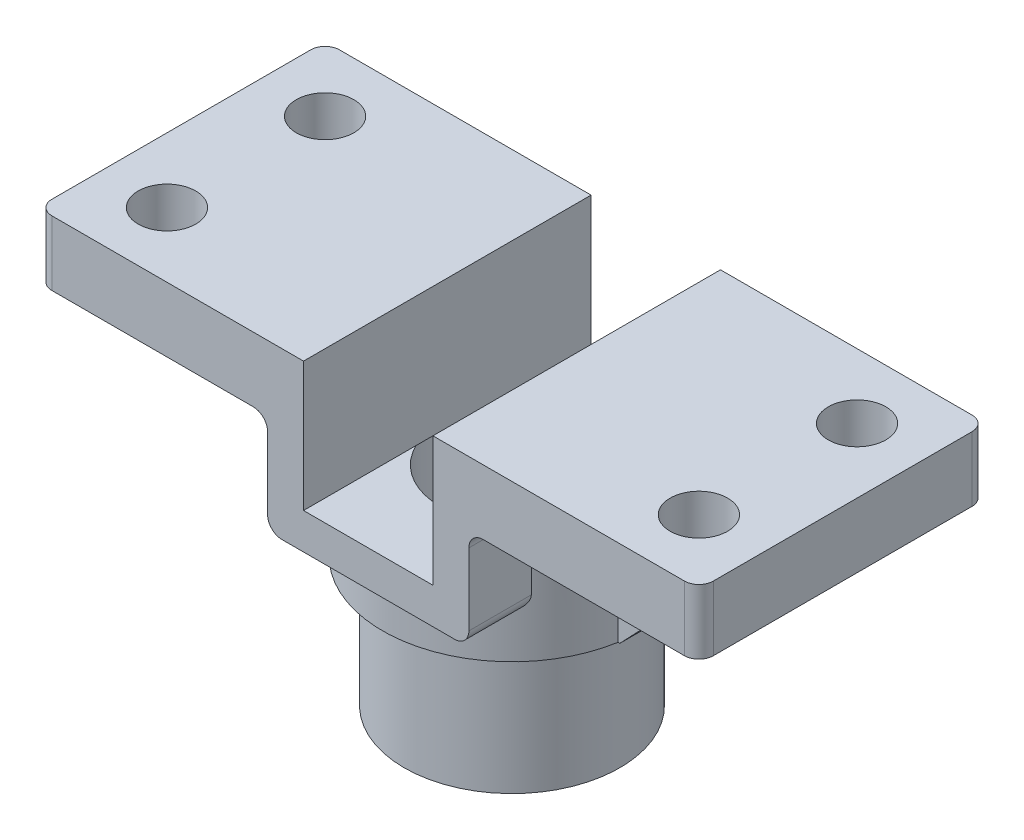
from build123d import *

# Parameters (mm, degrees)
SKETCH1_W           = 92
SKETCH1_H           = 40
SKETCH1_R           = 4
BOSS_EXTRUDE2_DEPTH = 9
SKETCH3_R           = 18
SKETCH3_R_2         = 10
BOSS_EXTRUDE3_DEPTH = 20
SKETCH4_R           = 15
SKETCH4_R_2         = 10
BOSS_EXTRUDE4_DEPTH = 18
CUT_EXTRUDE1_REACH  = 73.833
SKETCH8_W           = 18
SKETCH8_H           = 18
CUT_EXTRUDE2_REACH  = 73.833
SKETCH9_W           = 28
SKETCH9_H           = 14
BOSS_EXTRUDE5_DEPTH = 40
BOSS_EXTRUDE9_DEPTH = 3
CUT_EXTRUDE5_REACH  = 73.833
SKETCH8_3_W         = 18
SKETCH8_3_H         = 18
CUT_EXTRUDE6_START  = -6
CUT_EXTRUDE6_DEPTH  = 6
CUT_EXTRUDE7_START  = -5
SKETCH19_R          = 10
CUT_EXTRUDE7_DEPTH  = 5
FILLET1_R           = 2
FILLET2_R           = 2


with BuildPart() as part:
    # Sketch1 → Boss-Extrude2 (new body)
    with BuildSketch(Plane(origin=(0, 0, 0), x_dir=(1, 0, 0), z_dir=(0, 1, 0))):
        Rectangle(SKETCH1_W, SKETCH1_H)
        with Locations(Location((-37, 11, 0), (0, 0, 270))):
            Circle(SKETCH1_R, mode=Mode.SUBTRACT)
        with Locations(Location((-37, -11, 0), (0, 0, 270))):
            Circle(SKETCH1_R, mode=Mode.SUBTRACT)
        with Locations(Location((37, -11, 0), (0, 0, 90))):
            Circle(SKETCH1_R, mode=Mode.SUBTRACT)
        with Locations(Location((37, 11, 0), (0, 0, 90))):
            Circle(SKETCH1_R, mode=Mode.SUBTRACT)
    extrude(amount=BOSS_EXTRUDE2_DEPTH)

    # Sketch3 → Boss-Extrude3 (add)
    with BuildSketch(Plane.XZ):
        with Locations(Location((0, 0, 0), (0, 0, 270))):
            Circle(SKETCH3_R)
        with Locations(Location((0, 0, 0), (0, 0, 270))):
            Circle(SKETCH3_R_2, mode=Mode.SUBTRACT)
    extrude(amount=BOSS_EXTRUDE3_DEPTH)

    # Sketch4 → Boss-Extrude4 (add)
    with BuildSketch(Plane.XZ.offset(20)):
        with Locations(Location((0, 0, 0), (0, 0, 270))):
            Circle(SKETCH4_R)
        with Locations(Location((0, 0, 0), (0, 0, 270))):
            Circle(SKETCH4_R_2, mode=Mode.SUBTRACT)
    extrude(amount=BOSS_EXTRUDE4_DEPTH)

    # Sketch8 → Cut-Extrude1 (cut, up to next)
    with BuildSketch(Plane.XY.offset(20), mode=Mode.PRIVATE) as cut_extrude1_sk1:
        Rectangle(SKETCH8_W, SKETCH8_H)
    cut_extrude1_tool1 = extrude(cut_extrude1_sk1.sketch, amount=-CUT_EXTRUDE1_REACH, mode=Mode.PRIVATE) & part.part
    add(cut_extrude1_tool1.solids().sort_by_distance((0, 0, 20))[0], mode=Mode.SUBTRACT)

    # Sketch9 → Cut-Extrude2 (cut, up to next)
    with BuildSketch(Plane.XY.offset(20), mode=Mode.PRIVATE) as cut_extrude2_sk1:
        with Locations((0, -7)):
            Rectangle(SKETCH9_W, SKETCH9_H)
    cut_extrude2_tool1 = extrude(cut_extrude2_sk1.sketch, amount=-CUT_EXTRUDE2_REACH, mode=Mode.PRIVATE) & part.part
    add(cut_extrude2_tool1.solids().sort_by_distance((0, -7, 20))[0], mode=Mode.SUBTRACT)

    # Sketch10 → Boss-Extrude5 (add)
    with BuildSketch(Plane.XY.offset(20)):
        Polygon((9, 0), (9, -9), (-8.881269958, -9), (-9, 0), (-14, 0), (-14, -14), (14, -14), (14, 0), align=None)
    extrude(amount=-BOSS_EXTRUDE5_DEPTH)

    # Sketch13 → Boss-Extrude9 (add, symmetric)
    with BuildSketch(Plane.XY):
        Polygon((-18, -20), (-37, 0), (-18, 0), (-9, 0), (9, 0), (18, 0), (37, 0), (18, -20), align=None)
    extrude(amount=BOSS_EXTRUDE9_DEPTH, both=True)

    # Sketch8<3> → Cut-Extrude5 (cut, up to next)
    with BuildSketch(Plane.XY.offset(20), mode=Mode.PRIVATE) as cut_extrude5_sk1:
        Rectangle(SKETCH8_3_W, SKETCH8_3_H)
    cut_extrude5_tool1 = extrude(cut_extrude5_sk1.sketch, amount=-CUT_EXTRUDE5_REACH, mode=Mode.PRIVATE) & part.part
    add(cut_extrude5_tool1.solids().sort_by_distance((0, 0, 20))[0], mode=Mode.SUBTRACT)

    # Sketch18 → Cut-Extrude6 (cut)
    with BuildSketch(Plane.XZ.offset(20).offset(CUT_EXTRUDE6_START)):
        with BuildLine():
            Line((9.539392014, 3), (-9.539392014, 3))
            ThreePointArc((-9.539392014, 3), (-10, 0), (-9.539392014, -3))
            Line((-9.539392014, -3), (9.539392014, -3))
            ThreePointArc((9.539392014, -3), (10, 0), (9.539392014, 3))
        make_face()
    extrude(amount=CUT_EXTRUDE6_DEPTH, mode=Mode.SUBTRACT)

    # Sketch19 → Cut-Extrude7 (cut)
    with BuildSketch(Plane.XZ.offset(14).offset(CUT_EXTRUDE7_START)):
        with Locations(Location((0, 0, 0), (0, 0, 25.841932763))):
            Circle(SKETCH19_R)
    extrude(amount=CUT_EXTRUDE7_DEPTH, mode=Mode.SUBTRACT)

    # Fillet1
    fillet1_edges = [part.edges().sort_by_distance(p)[0] for p in [
        (46, 4.5, 20),
        (-46, 4.5, 20),
        (-46, 4.5, -20),
        (46, 4.5, -20),
    ]]
    fillet(fillet1_edges, radius=FILLET1_R)

    # Fillet2
    fillet2_edges = [part.edges().sort_by_distance(p)[0] for p in [
        (14, -14, 15.656854249),
        (14, -14, -15.656854249),
        (14, 0, -15.656854249),
        (14, 0, 15.656854249),
        (-14, -14, 15.656854249),
        (-14, -14, -15.656854249),
        (-14, 0, -15.656854249),
        (-14, 0, 15.656854249),
    ]]
    fillet(fillet2_edges, radius=FILLET2_R)


solid = part.part
